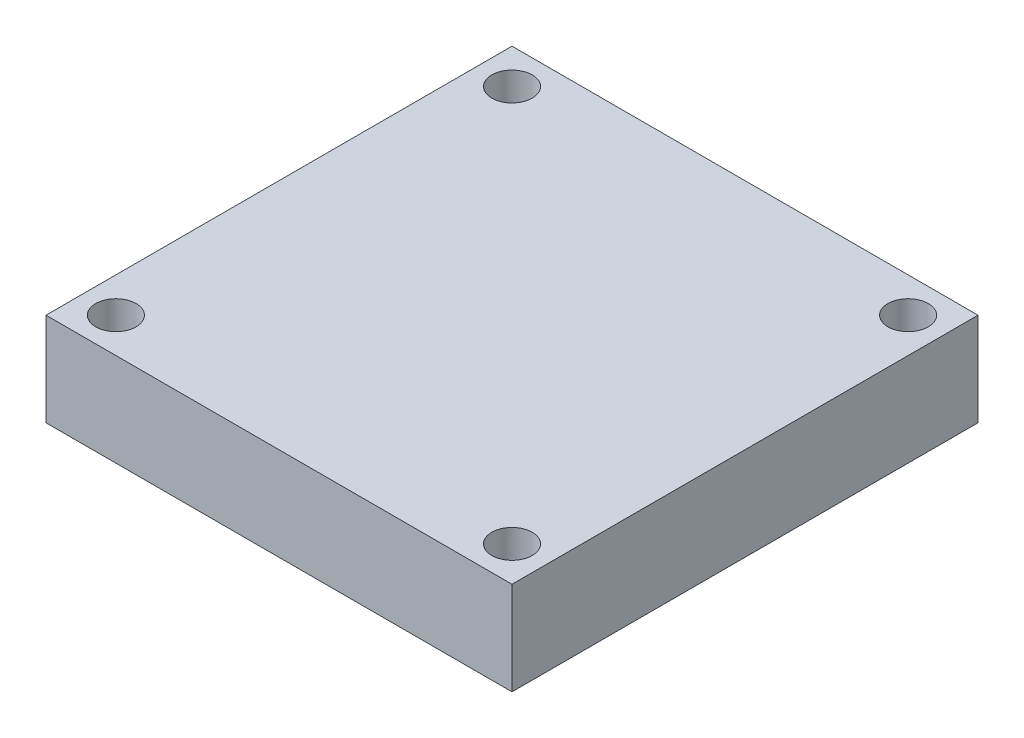
from build123d import *

# Parameters (mm, degrees)
SKETCH1_W           = 30
SKETCH1_H           = 30
SKETCH1_R           = 1.3
BOSS_EXTRUDE1_DEPTH = 6


with BuildPart() as part:
    # Sketch1 → Boss-Extrude1 (new body)
    with BuildSketch(Plane(origin=(0, 0, 0), x_dir=(1, 0, 0), z_dir=(0, 1, 0))):
        Rectangle(SKETCH1_W, SKETCH1_H)
        with Locations(Location((-12.75, 12.75, 0), (0, 0, 270))):
            Circle(SKETCH1_R, mode=Mode.SUBTRACT)
        with Locations(Location((12.75, 12.75, 0), (0, 0, 270))):
            Circle(SKETCH1_R, mode=Mode.SUBTRACT)
        with Locations(Location((12.75, -12.75, 0), (0, 0, 270))):
            Circle(SKETCH1_R, mode=Mode.SUBTRACT)
        with Locations(Location((-12.75, -12.75, 0), (0, 0, 270))):
            Circle(SKETCH1_R, mode=Mode.SUBTRACT)
    extrude(amount=BOSS_EXTRUDE1_DEPTH)


solid = part.part
